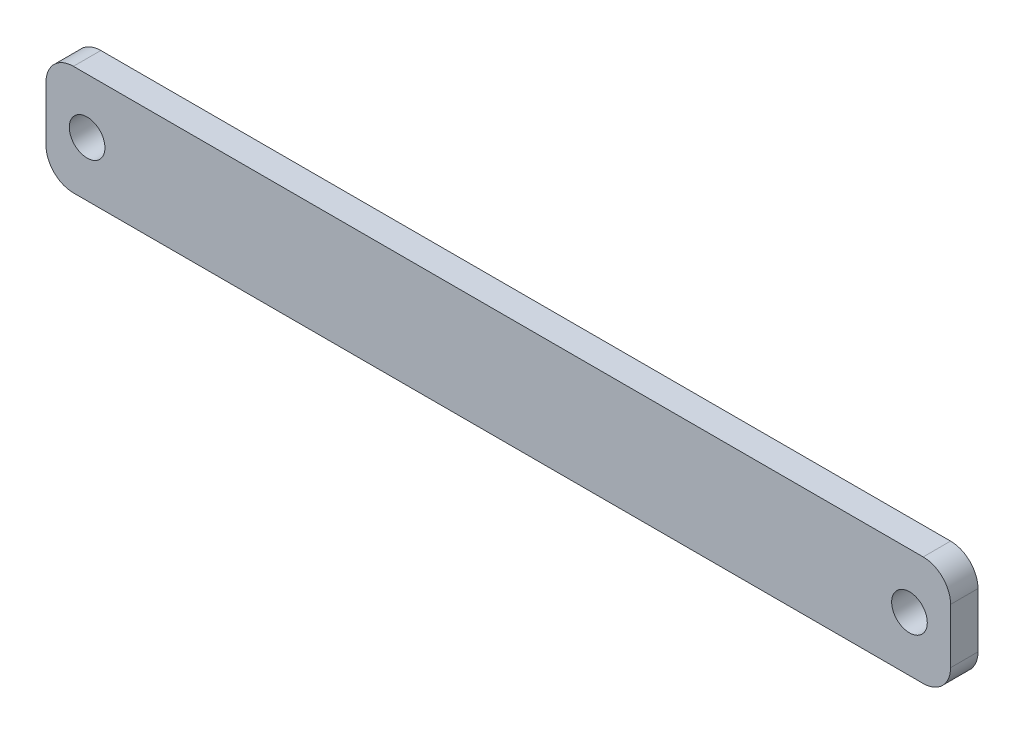
from build123d import *

# Parameters (mm, degrees)
SKETCH1_R           = 6.5
BOSS_EXTRUDE1_DEPTH = 10


with BuildPart() as part:
    # Sketch1 → Boss-Extrude1 (new body)
    with BuildSketch(Plane.XY):
        with BuildLine():
            Line((-155, 20), (155, 20))
            ThreePointArc((155, 20), (162.071067812, 17.071067812), (165, 10))
            Line((165, 10), (165, -10))
            ThreePointArc((165, -10), (162.071067812, -17.071067812), (155, -20))
            Line((155, -20), (-155, -20))
            ThreePointArc((-155, -20), (-162.071067812, -17.071067812), (-165, -10))
            Line((-165, -10), (-165, 10))
            ThreePointArc((-165, 10), (-162.071067812, 17.071067812), (-155, 20))
        make_face()
        with Locations((-150, 0)):
            Circle(SKETCH1_R, mode=Mode.SUBTRACT)
        with Locations((150, 0)):
            Circle(SKETCH1_R, mode=Mode.SUBTRACT)
    extrude(amount=BOSS_EXTRUDE1_DEPTH)


solid = part.part
